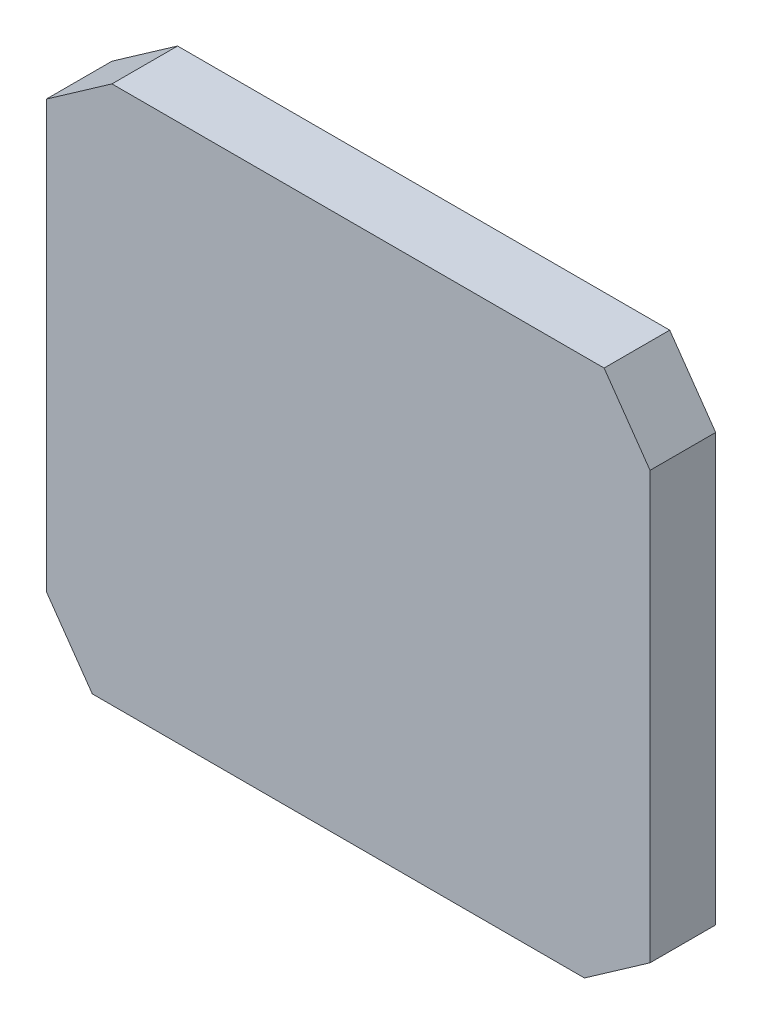
from build123d import *
from OCP.BRepFilletAPI import BRepFilletAPI_MakeChamfer

# Parameters (mm, degrees)
SKETCH_1_W      = 184
SKETCH_1_H      = 164
EXTRUDE_1_DEPTH = 20
CHAMFER_1_SIZE  = 20
CHAMFER_1_SIZE2 = 14.004150764


with BuildPart() as part:
    # 草图1 → 凸台-拉伸1 (new body)
    with BuildSketch(Plane.XY):
        Rectangle(SKETCH_1_W, SKETCH_1_H)
    extrude(amount=EXTRUDE_1_DEPTH)

    # 倒角1: one chamfer whose edges measure the first distance from different faces: ONE call of the kernel's chamfer builder (chamfer() names one face for all edges)
    chamfer_1_edges_1 = [part.edges().sort_by_distance(p)[0] for p in [
        (92, -82, 10),
    ]]
    chamfer_1_side_1 = [part.faces().sort_by_distance(p)[0] for p in [
        (0, -82, 10),
    ]]
    chamfer_1_edges_2 = [part.edges().sort_by_distance(p)[0] for p in [
        (-92, -82, 10),
    ]]
    chamfer_1_side_2 = [part.faces().sort_by_distance(p)[0] for p in [
        (-92, 0, 10),
    ]]
    chamfer_1_edges_3 = [part.edges().sort_by_distance(p)[0] for p in [
        (-92, 82, 10),
    ]]
    chamfer_1_side_3 = [part.faces().sort_by_distance(p)[0] for p in [
        (0, 82, 10),
    ]]
    chamfer_1_edges_4 = [part.edges().sort_by_distance(p)[0] for p in [
        (92, 82, 10),
    ]]
    chamfer_1_side_4 = [part.faces().sort_by_distance(p)[0] for p in [
        (92, 0, 10),
    ]]
    chamfer_1 = BRepFilletAPI_MakeChamfer(part.part.solid().wrapped)
    for e in chamfer_1_edges_1:
        chamfer_1.Add(CHAMFER_1_SIZE, CHAMFER_1_SIZE2, e.wrapped, chamfer_1_side_1[0].wrapped)  # the first distance lies on this face
    for e in chamfer_1_edges_2:
        chamfer_1.Add(CHAMFER_1_SIZE, CHAMFER_1_SIZE2, e.wrapped, chamfer_1_side_2[0].wrapped)  # the first distance lies on this face
    for e in chamfer_1_edges_3:
        chamfer_1.Add(CHAMFER_1_SIZE, CHAMFER_1_SIZE2, e.wrapped, chamfer_1_side_3[0].wrapped)  # the first distance lies on this face
    for e in chamfer_1_edges_4:
        chamfer_1.Add(CHAMFER_1_SIZE, CHAMFER_1_SIZE2, e.wrapped, chamfer_1_side_4[0].wrapped)  # the first distance lies on this face
    add(Compound.cast(chamfer_1.Shape()), mode=Mode.REPLACE)


solid = part.part
